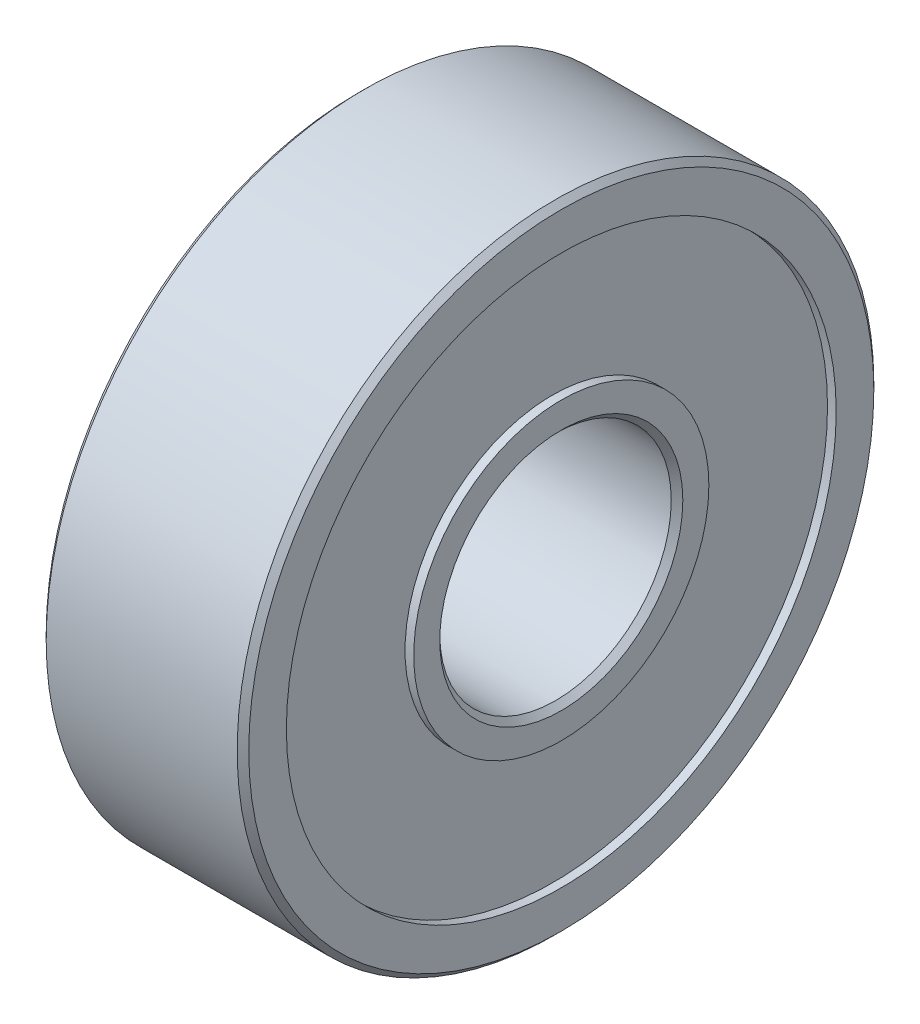
from build123d import *

# Parameters (mm, degrees)
CHAMFER1_SIZE = 0.2


with BuildPart() as part:
    # Sketch1 → Revolve1 (revolve)
    with BuildSketch(Plane.XY, mode=Mode.PRIVATE) as revolve1_sk:
        Polygon((3.5, 4), (-3.5, 4), (-3.5, 5.1), (-3.2, 5.1), (-3.2, 9.5), (-3.5, 9.5), (-3.5, 11), (3.5, 11), (3.5, 9.5), (3.2, 9.5), (3.2, 5.1), (3.5, 5.1), align=None)
    revolve(revolve1_sk.sketch.rotate(Axis((0, 0, 0), (-1, 0, 0)), 90), axis=Axis((0, 0, 0), (-1, 0, 0)))

    # Chamfer1
    chamfer1_edges = [part.edges().sort_by_distance(p)[0] for p in [
        (3.5, 0, 11),
        (-3.5, 0, 11),
        (-3.5, 0, 4),
        (3.5, 0, 4),
    ]]
    chamfer(chamfer1_edges, length=CHAMFER1_SIZE)


solid = part.part
